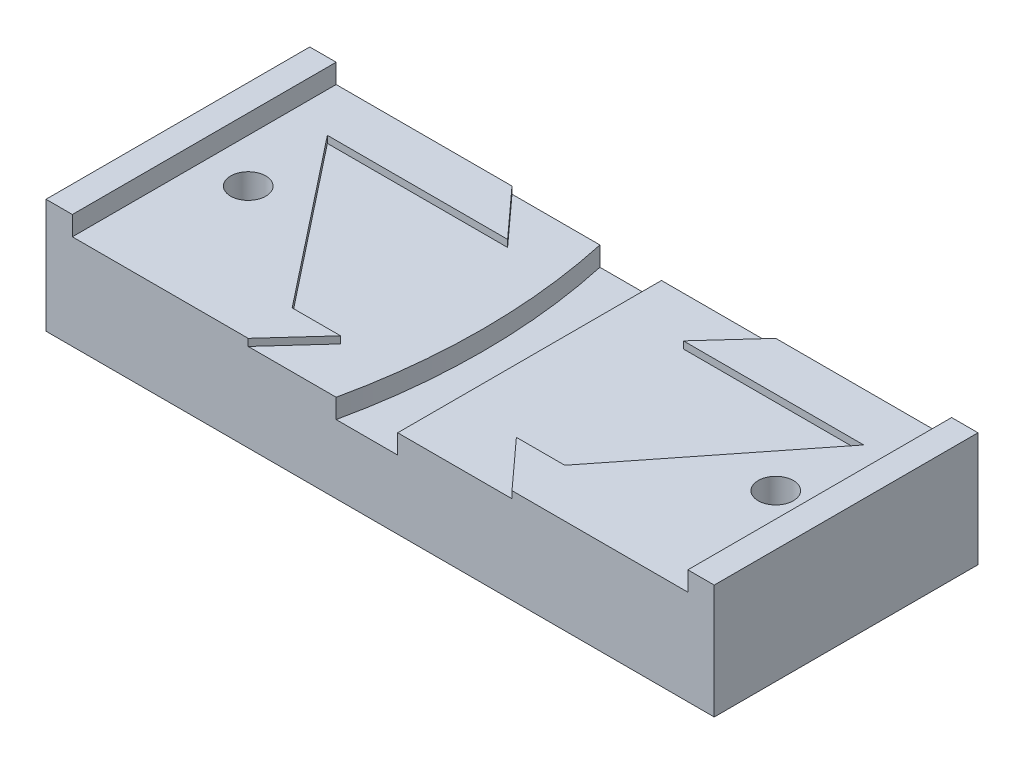
from build123d import *

# Parameters (mm, degrees)
SKETCH1_W           = 70
SKETCH1_H           = 30
BOSS_EXTRUDE1_DEPTH = 10
BOSS_EXTRUDE2_DEPTH = 0.8
CUT_EXTRUDE1_DEPTH  = 2.2
SKETCH4_R           = 2
CUT_EXTRUDE2_DEPTH  = 8
SKETCH5_W           = 3
SKETCH5_H           = 30
BOSS_EXTRUDE3_DEPTH = 13


with BuildPart() as part:
    # Sketch1 → Boss-Extrude1 (new body)
    with BuildSketch(Plane(origin=(0, 0, 0), x_dir=(1, 0, 0), z_dir=(0, 1, 0))):
        Rectangle(SKETCH1_W, SKETCH1_H)
    extrude(amount=BOSS_EXTRUDE1_DEPTH)

    # Sketch2 → Boss-Extrude2 (add)
    with BuildSketch(Plane(origin=(0, 10, 0), x_dir=(1, 0, 0), z_dir=(0, 1, 0))):
        Polygon((-15.5, -9.5), (-30.5, 9.5), (-10, 9.5), (-15, 15), (-35, 15), (-35, -15), (-15, -15), (-10, -9.5), align=None)
        Polygon((15, 15), (10, 9.5), (30.5, 9.5), (15.5, -9.5), (10, -9.5), (15, -15), (35, -15), (35, 15), align=None)
    extrude(amount=BOSS_EXTRUDE2_DEPTH)

    # Sketch3 → Cut-Extrude1 (cut)
    with BuildSketch(Plane(origin=(0, 10, 0), x_dir=(1, 0, 0), z_dir=(0, 1, 0))):
        with BuildLine():
            Line((2, 15), (2, -15))
            Line((2, -15), (-5, -15))
            ThreePointArc((-5, -15), (-3.373971656, 0), (-5, 15))
            Line((-5, 15), (2, 15))
        make_face()
    extrude(amount=-CUT_EXTRUDE1_DEPTH, mode=Mode.SUBTRACT)

    # Sketch4 → Cut-Extrude2 (cut)
    with BuildSketch(Plane(origin=(0, 10.8, 0), x_dir=(1, 0, 0), z_dir=(0, 1, 0))):
        with Locations((-30, 0)):
            Circle(SKETCH4_R)
        with Locations((30, 0)):
            Circle(SKETCH4_R)
    extrude(amount=-CUT_EXTRUDE2_DEPTH, mode=Mode.SUBTRACT)

    # Sketch5 → Boss-Extrude3 (add)
    with BuildSketch(Plane.XZ):
        with Locations((-36.5, 0)):
            Rectangle(SKETCH5_W, SKETCH5_H)
        with Locations((36.5, 0)):
            Rectangle(SKETCH5_W, SKETCH5_H)
    extrude(amount=-BOSS_EXTRUDE3_DEPTH)


solid = part.part
